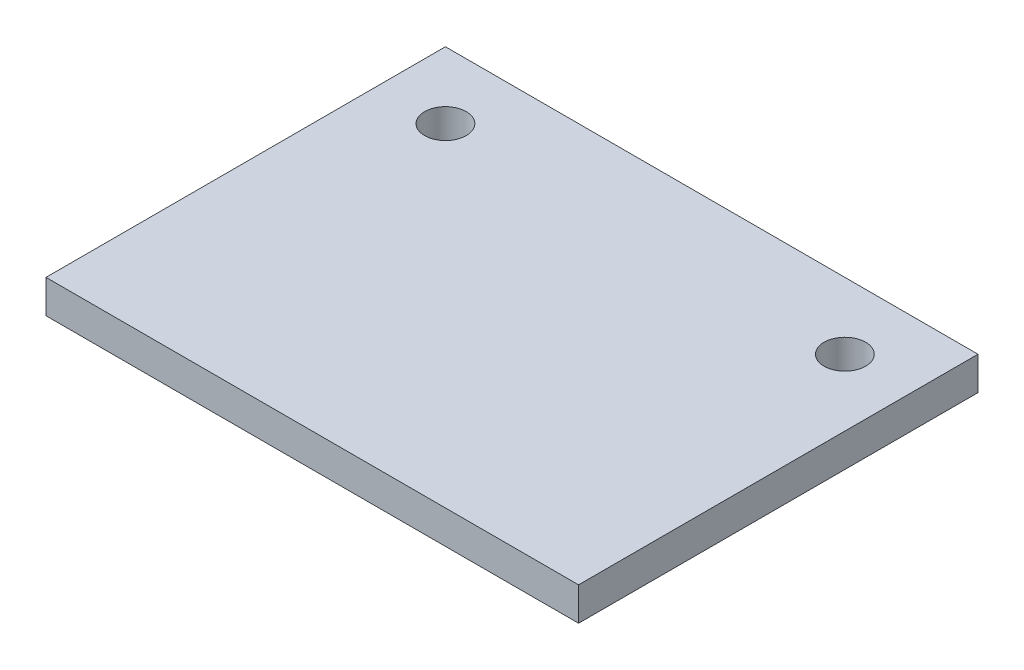
from build123d import *

# Parameters (mm, degrees)
SKETCH1_W           = 160
SKETCH1_H           = 120
SKETCH1_R           = 6.25
BOSS_EXTRUDE1_DEPTH = 10


with BuildPart() as part:
    # Sketch1 → Boss-Extrude1 (new body)
    with BuildSketch(Plane(origin=(0, 0, 0), x_dir=(1, 0, 0), z_dir=(0, 1, 0))):
        with Locations((-15.609756098, 3.512195122)):
            Rectangle(SKETCH1_W, SKETCH1_H)
        with Locations(Location((44.390243902, 43.512195122, 0), (0, 0, 270))):
            Circle(SKETCH1_R, mode=Mode.SUBTRACT)
        with Locations(Location((-75.609756098, 43.512195122, 0), (0, 0, 270))):
            Circle(SKETCH1_R, mode=Mode.SUBTRACT)
    extrude(amount=BOSS_EXTRUDE1_DEPTH)


solid = part.part
